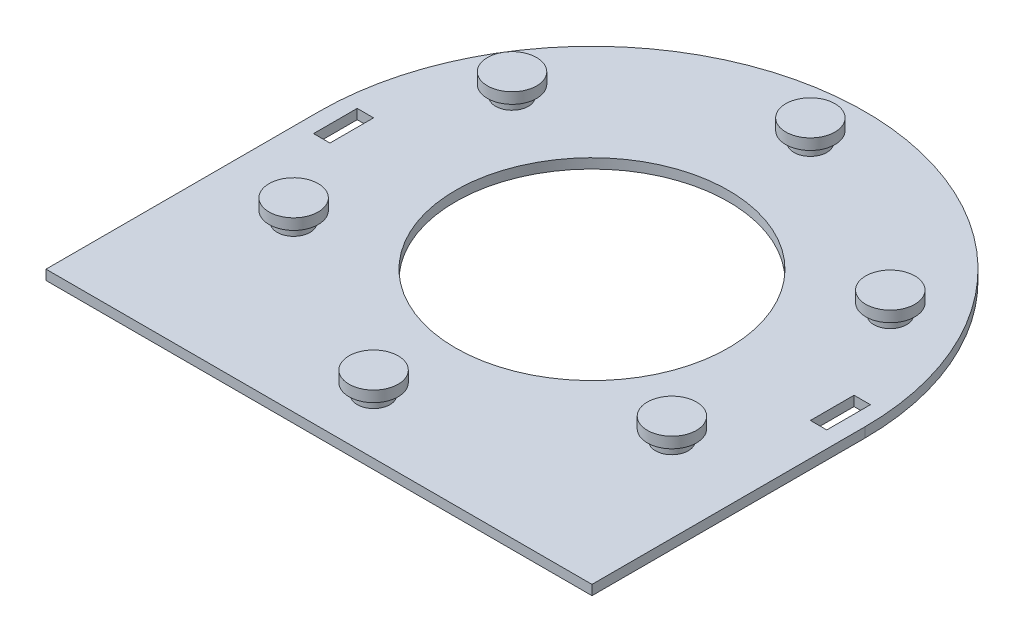
from build123d import *

# Parameters (mm, degrees)
BOSS_EXTRUDE1_DEPTH = 1.8
SKETCH2_R           = 25
CUT_EXTRUDE1_DEPTH  = 1.8
SKETCH2_3_R         = 4.5
BOSS_EXTRUDE2_DEPTH = 4
SKETCH2_4_R         = 4.5
SKETCH2_4_R_2       = 3
CUT_EXTRUDE2_DEPTH  = 2
CIRPATTERN1_COUNT   = 12
SKETCH5_W           = 3
SKETCH5_H           = 8
CUT_EXTRUDE3_DEPTH  = 1.8


with BuildPart() as part:
    # Sketch1 → Boss-Extrude1 (new body)
    with BuildSketch(Plane(origin=(0, 0, 0), x_dir=(1, 0, 0), z_dir=(0, 1, 0))):
        with BuildLine():
            Line((-50, 0), (-50, -50))
            Line((-50, -50), (50, -50))
            Line((50, -50), (50, 0))
            ThreePointArc((50, 0), (0, 50), (-50, 0))
        make_face()
    extrude(amount=BOSS_EXTRUDE1_DEPTH)

    # Sketch2 → Cut-Extrude1 (cut)
    with BuildSketch(Plane(origin=(0, 1.8, 0), x_dir=(1, 0, 0), z_dir=(0, 1, 0))):
        with Locations(Location((0, 0, 0), (0, 0, 270))):
            Circle(SKETCH2_R)
    extrude(amount=-CUT_EXTRUDE1_DEPTH, mode=Mode.SUBTRACT)

    # Sketch2<3> → Boss-Extrude2 (add)
    with BuildSketch(Plane(origin=(0, 1.8, 0), x_dir=(1, 0, 0), z_dir=(0, 1, 0))):
        with Locations(Location((0, -40, 0), (0, 0, 270))):
            Circle(SKETCH2_3_R)
    boss_extrude2 = extrude(amount=BOSS_EXTRUDE2_DEPTH)

    # Sketch2<4> → Cut-Extrude2 (cut)
    with BuildSketch(Plane(origin=(0, 1.8, 0), x_dir=(1, 0, 0), z_dir=(0, 1, 0))):
        with Locations(Location((0, -40, 0), (0, 0, 270))):
            Circle(SKETCH2_4_R)
        with Locations(Location((0, -40, 0), (0, 0, 270))):
            Circle(SKETCH2_4_R_2, mode=Mode.SUBTRACT)
    cut_extrude2 = extrude(amount=CUT_EXTRUDE2_DEPTH, mode=Mode.SUBTRACT)

    # CirPattern1: Boss-Extrude2, Cut-Extrude2 ×12 about axis, 6 skipped
    cirpattern1_axis = Axis((0, -70.710678119, 0), (0, 1, 0))
    add([boss_extrude2.rotate(cirpattern1_axis, i * 360 / CIRPATTERN1_COUNT) for i in range(1, CIRPATTERN1_COUNT) if i not in (1, 3, 5, 7, 9, 11)])
    add([cut_extrude2.rotate(cirpattern1_axis, i * 360 / CIRPATTERN1_COUNT) for i in range(1, CIRPATTERN1_COUNT) if i not in (1, 3, 5, 7, 9, 11)], mode=Mode.SUBTRACT)

    # Sketch5 → Cut-Extrude3 (cut)
    with BuildSketch(Plane(origin=(0, 1.8, 0), x_dir=(1, 0, 0), z_dir=(0, 1, 0))):
        with Locations((-45.5, 0)):
            Rectangle(SKETCH5_W, SKETCH5_H)
        with Locations((45.5, 0)):
            Rectangle(SKETCH5_W, SKETCH5_H)
    extrude(amount=-CUT_EXTRUDE3_DEPTH, mode=Mode.SUBTRACT)


solid = part.part
